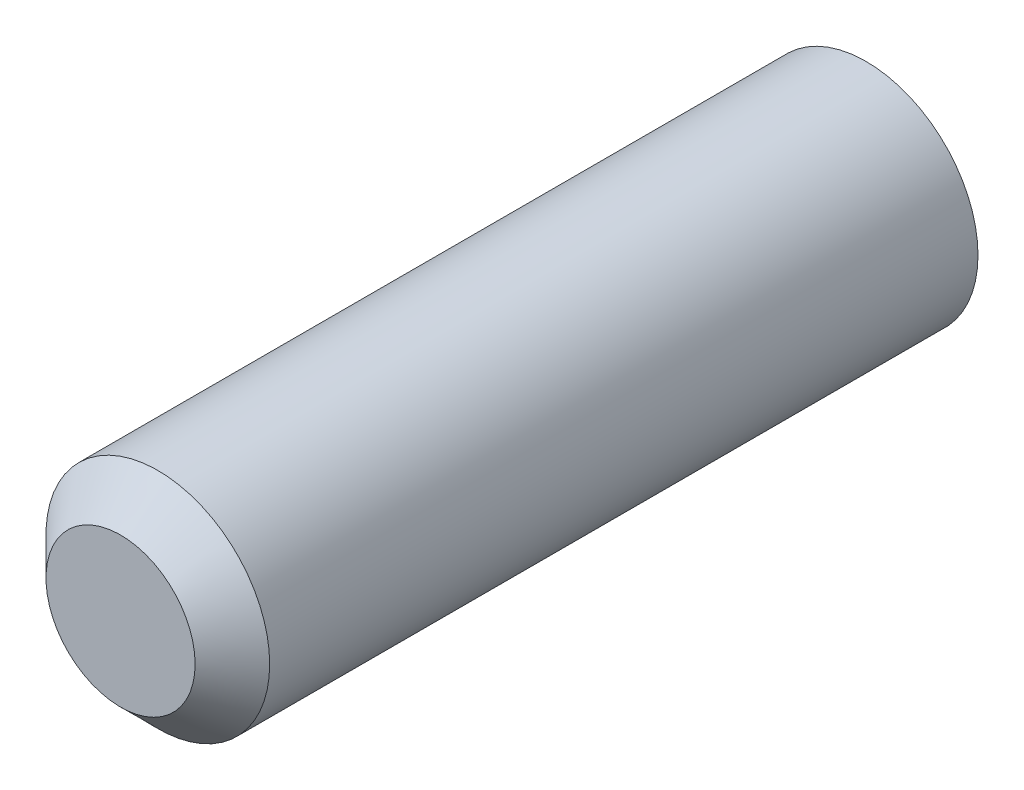
from build123d import *

# Parameters (mm, degrees)
ESQUISSE1_R      = 1.5
EXTRUSION1_DEPTH = 10
CHANFREIN1_SIZE  = 0.5


with BuildPart() as part:
    # Esquisse1 → Extrusion1 (new body)
    with BuildSketch(Plane.XY):
        Circle(ESQUISSE1_R)
    extrude(amount=EXTRUSION1_DEPTH)

    # Chanfrein1
    chanfrein1_edges = [part.edges().sort_by_distance(p)[0] for p in [
        (-1.5, 0, 10),
    ]]
    chamfer(chanfrein1_edges, length=CHANFREIN1_SIZE)


solid = part.part
